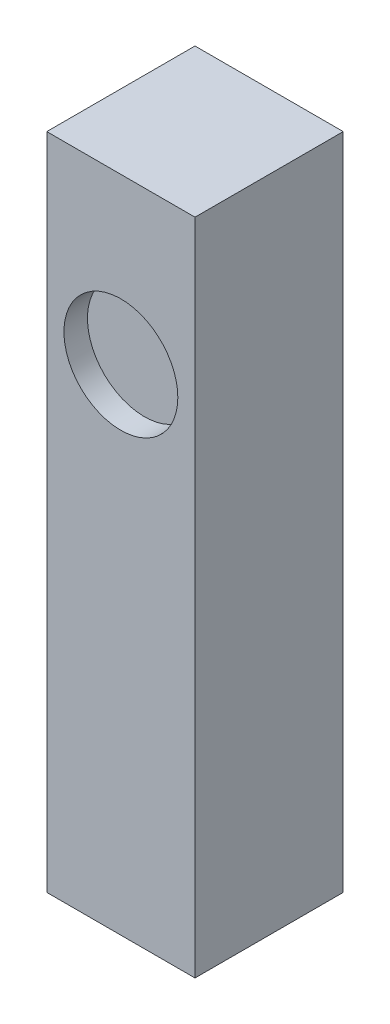
from build123d import *

# Parameters (mm, degrees)
BOSS_EXTRUDE1_DEPTH = 711.2
SKETCH3_R           = 61.468
CUT_EXTRUDE1_DEPTH  = 25.4


with BuildPart() as part:
    # Sketch1 → Boss-Extrude1 (new body)
    with BuildSketch(Plane(origin=(0, 0, 0), x_dir=(1, 0, 0), z_dir=(0, 1, 0))):
        Polygon((0, 80), (-80, 80), (-80, 0), (-80, -80), (0, -80), (80, -80), (80, 0), (80, 80), align=None)
    extrude(amount=BOSS_EXTRUDE1_DEPTH)

    # Sketch3 → Cut-Extrude1 (cut)
    with BuildSketch(Plane.XY.offset(80)):
        with Locations((0, 533.4)):
            Circle(SKETCH3_R)
    extrude(amount=-CUT_EXTRUDE1_DEPTH, mode=Mode.SUBTRACT)


solid = part.part
